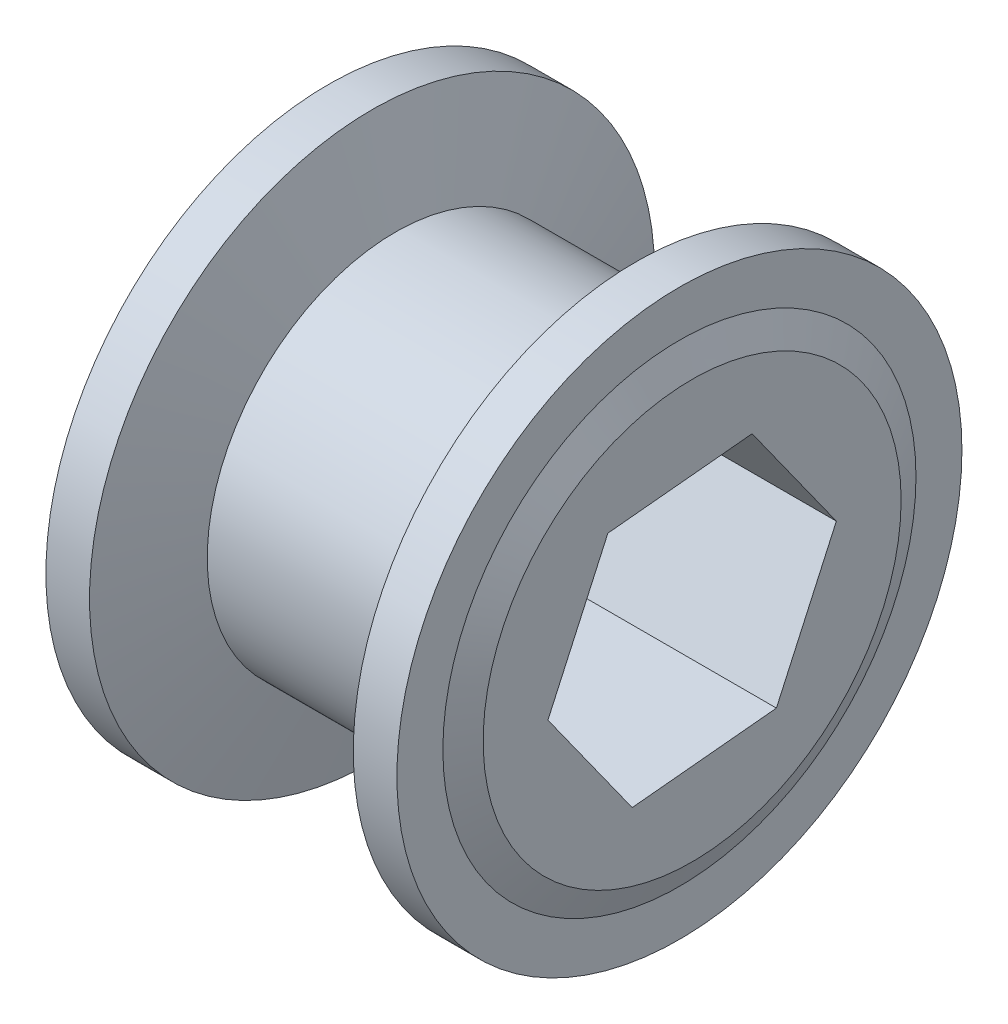
from build123d import *

# Parameters (mm, degrees)
CUT_EXTRUDE1_DEPTH = 28.77920446


with BuildPart() as part:
    # Sketch2 → Revolve1 (revolve)
    with BuildSketch(Plane.XY, mode=Mode.PRIVATE) as revolve1_sk:
        Polygon((0, 9.525), (0, 0), (9.525, 0), (9.525, 10.575392629), (8.881774662, 11.97073299), (8.881774662, 14.296532804), (6.673429623, 14.296532804), (5.487800488, 9.525), align=None)
        Polygon((-9.525, 0), (0, 0), (0, 9.525), (-5.487800488, 9.525), (-6.673429623, 14.296532804), (-8.881774662, 14.296532804), (-8.881774662, 11.97073299), (-9.525, 10.575392629), align=None)
    revolve(revolve1_sk.sketch.rotate(Axis((14.160671305, 0, 0), (-1, 0, 0)), 90), axis=Axis((14.160671305, 0, 0), (-1, 0, 0)))

    # Sketch3 → Cut-Extrude1 (cut, through all)
    with BuildSketch(Plane(origin=(9.525, 0, 0), x_dir=(0, 0, -1), z_dir=(1, 0, 0))):
        Polygon((4.264354564, -5.964781093), (7.297829236, 0.710648837), (3.033474672, 6.67542993), (-4.264354564, 5.964781093), (-7.297829236, -0.710648837), (-3.033474672, -6.67542993), align=None)
    extrude(amount=-CUT_EXTRUDE1_DEPTH, mode=Mode.SUBTRACT)


solid = part.part
